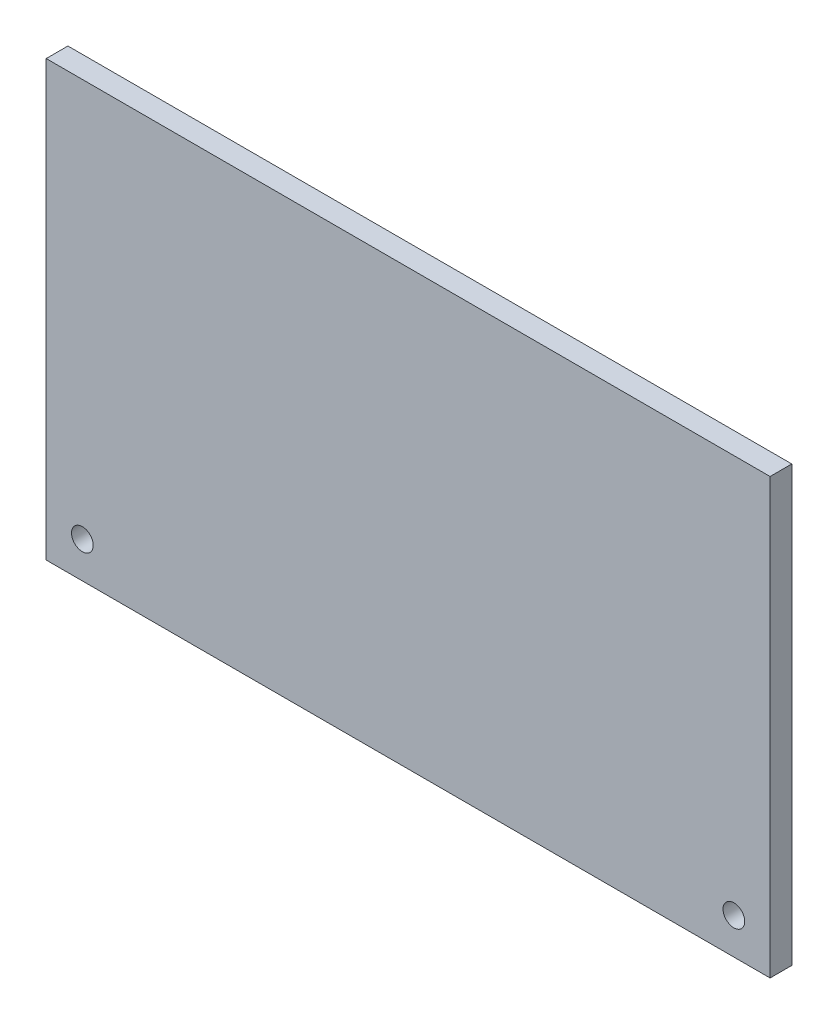
from build123d import *

# Parameters (mm, degrees)
SKETCH1_W           = 100
SKETCH1_H           = 60
BOSS_EXTRUDE1_DEPTH = 3
SKETCH2_R           = 1.5
CUT_EXTRUDE1_DEPTH  = 3


with BuildPart() as part:
    # Sketch1 → Boss-Extrude1 (new body)
    with BuildSketch(Plane.XY):
        with Locations((-7.495590829, 4.038800705)):
            Rectangle(SKETCH1_W, SKETCH1_H)
    extrude(amount=BOSS_EXTRUDE1_DEPTH)

    # Sketch2 → Cut-Extrude1 (cut)
    with BuildSketch(Plane.XY.offset(3)):
        with Locations((37.504409171, -20.961199295)):
            Circle(SKETCH2_R)
        with Locations((-52.500025419, -20.961199295)):
            Circle(SKETCH2_R)
    extrude(amount=-CUT_EXTRUDE1_DEPTH, mode=Mode.SUBTRACT)


solid = part.part
